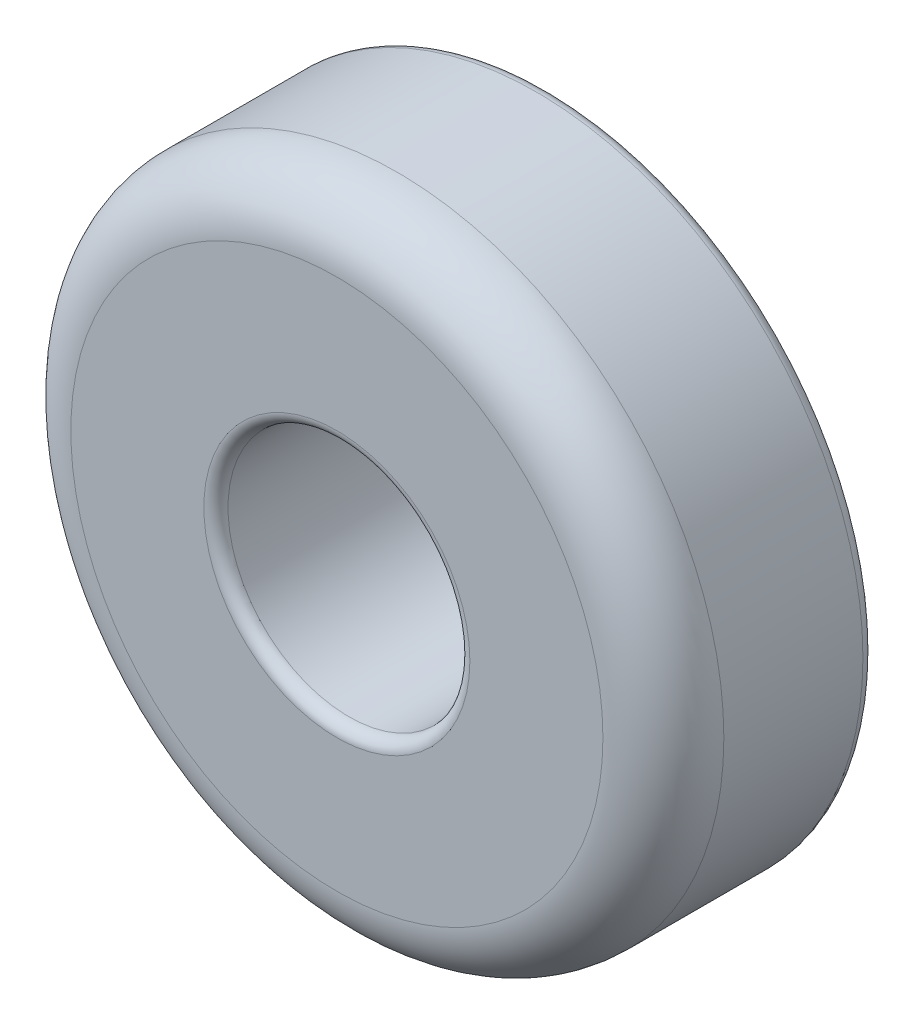
from build123d import *

# Parameters (mm, degrees)
SKETCH1_R           = 2.7
SKETCH1_R_2         = 1
EXTRUDE_THIN1_DEPTH = 1.75
FILLET1_R           = 0.5
FILLET2_R           = 0.1


with BuildPart() as part:
    # Sketch1 → Extrude-Thin1 (new body)
    with BuildSketch(Plane.XY):
        Circle(SKETCH1_R)
        Circle(SKETCH1_R_2, mode=Mode.SUBTRACT)
    extrude(amount=EXTRUDE_THIN1_DEPTH)

    # Fillet1
    fillet1_edges = [part.edges().sort_by_distance(p)[0] for p in [
        (-2.7, 0, 1.75),
    ]]
    fillet(fillet1_edges, radius=FILLET1_R)

    # Fillet2
    fillet2_edges = [part.edges().sort_by_distance(p)[0] for p in [
        (-2.7, 0, 0),
        (-1, 0, 1.75),
    ]]
    fillet(fillet2_edges, radius=FILLET2_R)


solid = part.part
